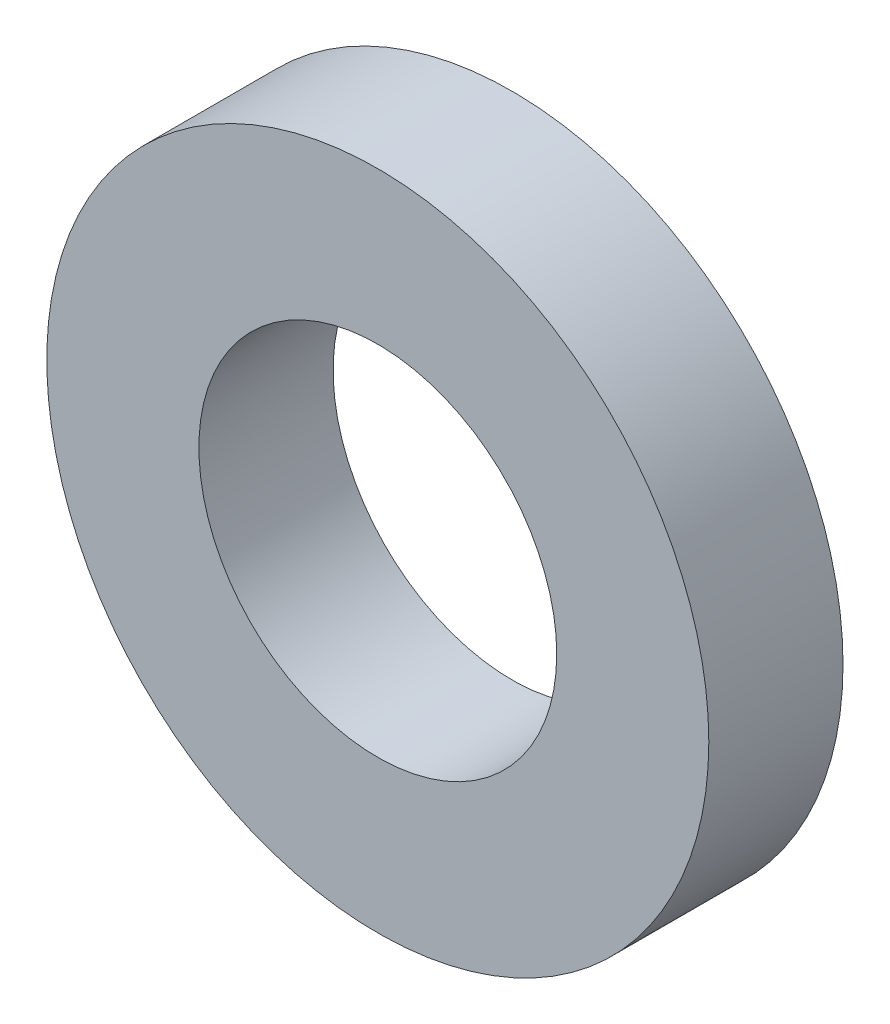
from build123d import *

# Parameters (mm, degrees)
SCHIZZO1_R                   = 7.4
SCHIZZO1_R_2                 = 4
ESTRUSIONE_ESTRUSIONE1_DEPTH = 3


with BuildPart() as part:
    # Schizzo1 → Estrusione-Estrusione1 (new body)
    with BuildSketch(Plane.XY):
        Circle(SCHIZZO1_R)
        Circle(SCHIZZO1_R_2, mode=Mode.SUBTRACT)
    extrude(amount=ESTRUSIONE_ESTRUSIONE1_DEPTH)


solid = part.part
